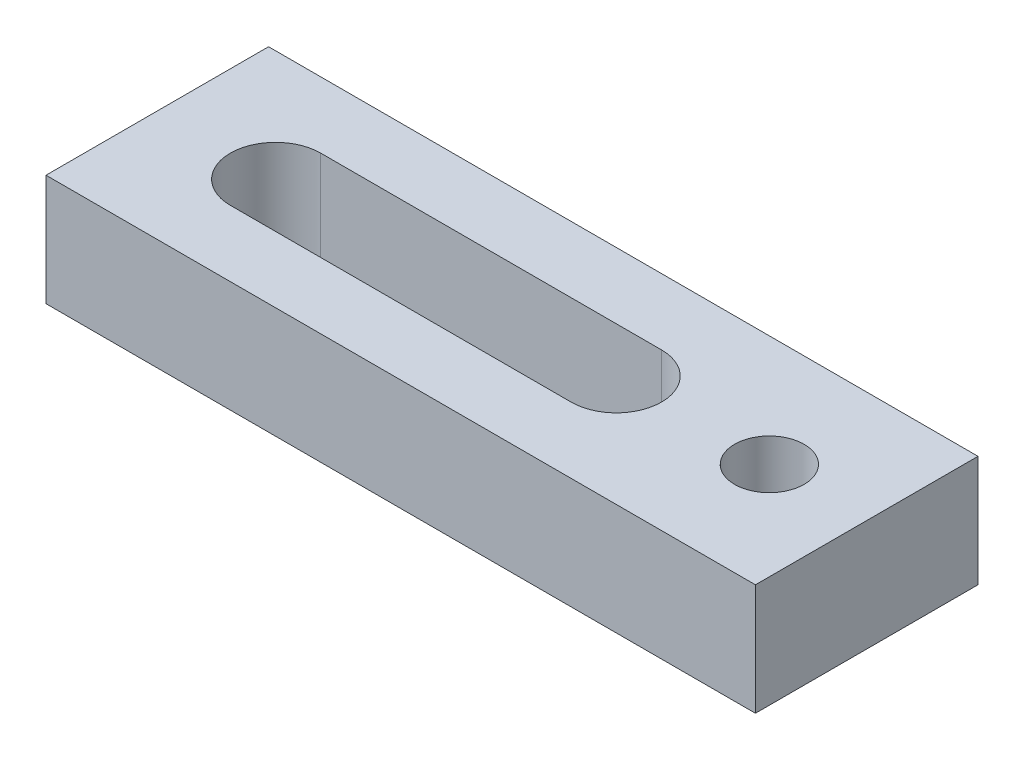
from build123d import *

# Parameters (mm, degrees)
CROQUIS3_W              = 51
CROQUIS3_H              = 16
SALIENTE_EXTRUIR1_DEPTH = 8
CORTAR_EXTRUIR4_DEPTH   = 55.046276467
CROQUIS32_R             = 2.5
CORTAR_EXTRUIR6_DEPTH   = 55.046276467


with BuildPart() as part:
    # Croquis3 → Saliente-Extruir1 (new body)
    with BuildSketch(Plane(origin=(0, 0, 0), x_dir=(1, 0, 0), z_dir=(0, 1, 0))):
        with Locations((25.5, 8)):
            Rectangle(CROQUIS3_W, CROQUIS3_H)
    extrude(amount=SALIENTE_EXTRUIR1_DEPTH)

    # Croquis15 → Cortar-Extruir4 (cut, through all)
    with BuildSketch(Plane(origin=(0, 8, 0), x_dir=(1, 0, 0), z_dir=(0, 1, 0))):
        with BuildLine():
            Line((8.5, 11.25), (33, 11.25))
            ThreePointArc((33, 11.25), (36.25, 8), (33, 4.75))
            Line((33, 4.75), (8.5, 4.75))
            ThreePointArc((8.5, 4.75), (5.25, 8), (8.5, 11.25))
        make_face()
    extrude(amount=-CORTAR_EXTRUIR4_DEPTH, mode=Mode.SUBTRACT)

    # Croquis32 → Cortar-Extruir6 (cut, through all)
    with BuildSketch(Plane(origin=(0, 8, 0), x_dir=(1, 0, 0), z_dir=(0, 1, 0))):
        with Locations(Location((44, 8, 0), (0, 0, 270))):
            Circle(CROQUIS32_R)
    extrude(amount=-CORTAR_EXTRUIR6_DEPTH, mode=Mode.SUBTRACT)


solid = part.part
